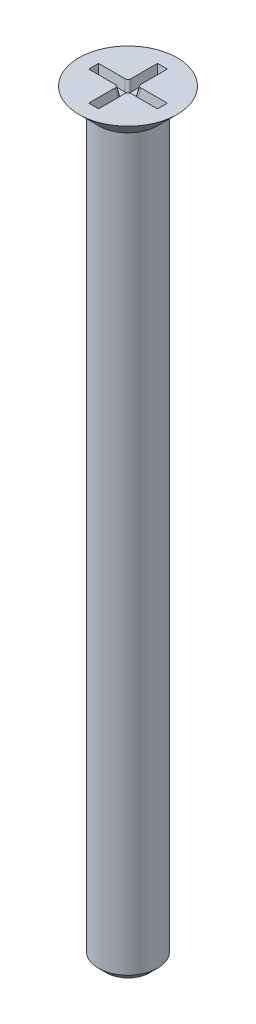
from build123d import *

# Parameters (mm, degrees)
SKETCH_2_R                    = 3
EXTRUDE_1_DEPTH               = 75
CHAMFER_1_SIZE                = 0.8
SKETCH_3_W                    = 7
SKETCH_3_H                    = 1
CUT_EXTRUDE_1_DEPTH           = 1
CUT_EXTRUDE_1_DRAFT           = -10
SKETCH_3_W_2                  = 1
SKETCH_3_H_2                  = 7
CUT_EXTRUDE_1_PROFILE_2_DEPTH = 1
CUT_EXTRUDE_1_PROFILE_2_DRAFT = -10
FILLET_1_R                    = 0.3


with BuildPart() as part:
    # 草图1 → 旋转1 (revolve)
    with BuildSketch(Plane.XY, mode=Mode.PRIVATE) as revolve_1_sk:
        Polygon((0, 0), (5, 0), (3, -2), (0, -2), align=None)
    revolve(revolve_1_sk.sketch.rotate(Axis((0, -2, 0), (0, 1, 0)), 90), axis=Axis((0, -2, 0), (0, 1, 0)))

    # 草图2 → 凸台-拉伸1 (add)
    with BuildSketch(Plane.XZ.offset(2)):
        with Locations(Location((0, 0, 0), (0, 0, 270))):
            Circle(SKETCH_2_R)
    extrude(amount=EXTRUDE_1_DEPTH)

    # 倒角1
    chamfer_1_edges = [part.edges().sort_by_distance(p)[0] for p in [
        (0, -77, 3),
    ]]
    chamfer(chamfer_1_edges, length=CHAMFER_1_SIZE)


with BuildPart() as cut_extrude_1_tool:
    # 草图3 → 切除-拉伸1 (with draft: the straight prism first)
    with BuildSketch(Plane(origin=(0, 0, 0), x_dir=(1, 0, 0), z_dir=(0, 1, 0))):
        Rectangle(SKETCH_3_W, SKETCH_3_H)
    extrude(amount=-CUT_EXTRUDE_1_DEPTH)
    # 切除-拉伸1: the draft: its side faces are tilted about the plane it starts from
    cut_extrude_1_sides = [cut_extrude_1_tool.faces().sort_by_distance(p)[0] for p in [
        (0, -0.5, 0.5),
        (3.5, -0.5, 0),
        (0, -0.5, -0.5),
        (-3.5, -0.5, 0),
    ]]
    draft(cut_extrude_1_sides, Plane(origin=(0, 0, 0), x_dir=(1, 0, 0), z_dir=(0, 1, 0)), CUT_EXTRUDE_1_DRAFT)


with BuildPart() as part_1:
    add(part.part)

    # 切除-拉伸1: cut by cut_extrude_1_tool
    add(cut_extrude_1_tool.part, mode=Mode.SUBTRACT)


with BuildPart() as cut_extrude_1_profile_2_tool:
    # 草图3 → 切除-拉伸1 profile 2 (with draft: the straight prism first)
    with BuildSketch(Plane(origin=(0, 0, 0), x_dir=(1, 0, 0), z_dir=(0, 1, 0))):
        Rectangle(SKETCH_3_W_2, SKETCH_3_H_2)
    extrude(amount=-CUT_EXTRUDE_1_PROFILE_2_DEPTH)
    # 切除-拉伸1 profile 2: the draft: its side faces are tilted about the plane it starts from
    cut_extrude_1_profile_2_sides = [cut_extrude_1_profile_2_tool.faces().sort_by_distance(p)[0] for p in [
        (-0.5, -0.5, 0),
        (0, -0.5, 3.5),
        (0.5, -0.5, 0),
        (0, -0.5, -3.5),
    ]]
    draft(cut_extrude_1_profile_2_sides, Plane(origin=(0, 0, 0), x_dir=(1, 0, 0), z_dir=(0, 1, 0)), CUT_EXTRUDE_1_PROFILE_2_DRAFT)


with BuildPart() as part_2:
    add(part_1.part)

    # 切除-拉伸1 profile 2: cut by cut_extrude_1_profile_2_tool
    add(cut_extrude_1_profile_2_tool.part, mode=Mode.SUBTRACT)

    # 圆角1
    fillet_1_edges = [part_2.edges().sort_by_distance(p)[0] for p in [
        (0.41183651, -0.5, -0.41183651),
        (0.41183651, -0.5, 0.41183651),
        (-0.41183651, -0.5, 0.41183651),
        (-0.41183651, -0.5, -0.41183651),
    ]]
    fillet(fillet_1_edges, radius=FILLET_1_R)


solid = part_2.part
